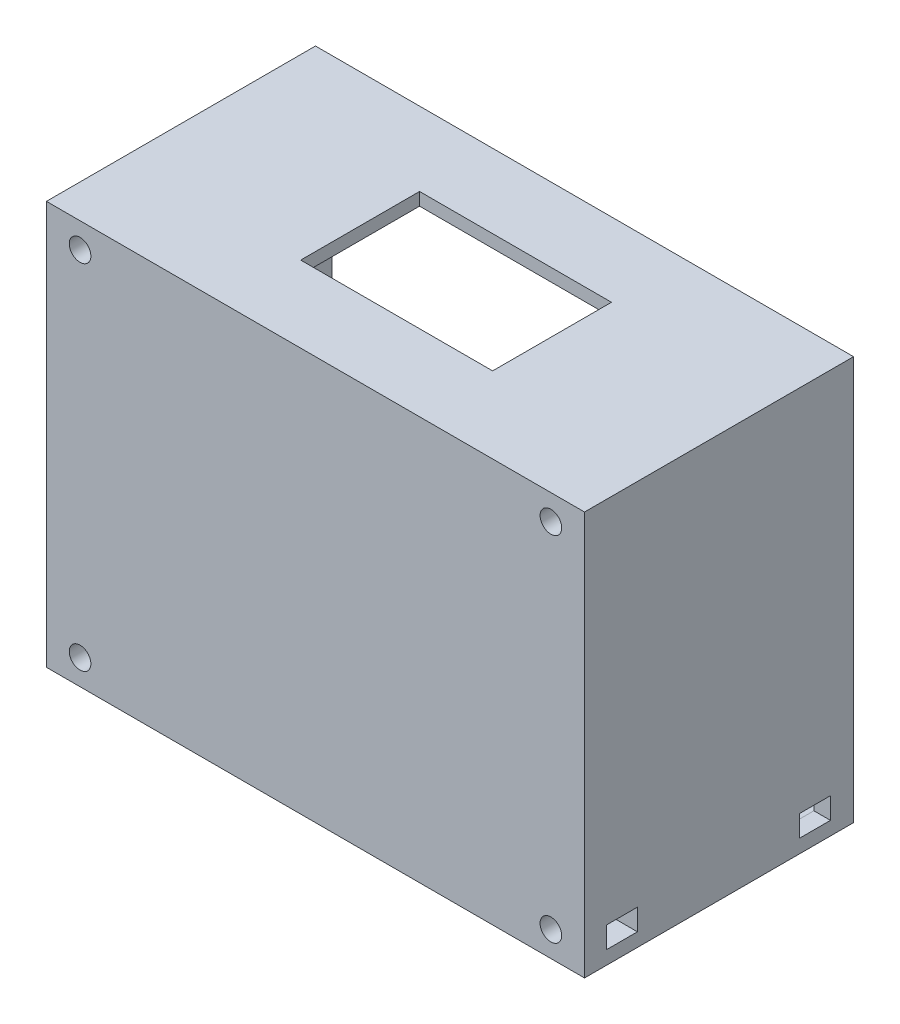
from build123d import *

# Parameters (mm, degrees)
ESBO_O1_W                = 200
ESBO_O1_H                = 150
ESBO_O1_R                = 4.015931703
RESSALTO_EXTRUS_O1_DEPTH = 100
ESBO_O2_W                = 187.670035944
ESBO_O2_H                = 140.530338622
CORTE_EXTRUS_O2_DEPTH    = 80
ESBO_O3_W                = 25.727524856
ESBO_O3_H                = 8.994175356
CORTE_EXTRUS_O3_DEPTH    = 103
ESBO_O4_W                = 11.504177781
ESBO_O4_H                = 7.948341013
CORTE_EXTRUS_O4_DEPTH    = 114
ESBO_O5_W                = 71.332240634
ESBO_O5_H                = 44.178578037
CORTE_EXTRUS_O5_DEPTH    = 114


with BuildPart() as part:
    # Esboço1 → Ressalto-extrusão1 (new body)
    with BuildSketch(Plane.XY):
        Rectangle(ESBO_O1_W, ESBO_O1_H)
        with Locations((-87.500730847, 65.625548135)):
            Circle(ESBO_O1_R, mode=Mode.SUBTRACT)
        with Locations(Location((-87.500730847, -65.625548135, 0), (0, 0, 180))):
            Circle(ESBO_O1_R, mode=Mode.SUBTRACT)
        with Locations(Location((87.500730847, 65.625548135, 0), (0, 0, 180))):
            Circle(ESBO_O1_R, mode=Mode.SUBTRACT)
        with Locations((87.500730847, -65.625548135)):
            Circle(ESBO_O1_R, mode=Mode.SUBTRACT)
    extrude(amount=RESSALTO_EXTRUS_O1_DEPTH)

    # Esboço2 → Corte-extrusão2 (cut)
    with BuildSketch(Plane.XY):
        Rectangle(ESBO_O2_W, ESBO_O2_H)
    extrude(amount=CORTE_EXTRUS_O2_DEPTH, mode=Mode.SUBTRACT)

    # Esboço3 → Corte-extrusão3 (cut)
    with BuildSketch(Plane(origin=(0, 0, 0), x_dir=(0, 0, -1), z_dir=(1, 0, 0))):
        with Locations((-20.821221809, -65.887563657)):
            Rectangle(ESBO_O3_W, ESBO_O3_H)
    extrude(amount=-CORTE_EXTRUS_O3_DEPTH, mode=Mode.SUBTRACT)

    # Esboço4 → Corte-extrusão4 (cut)
    with BuildSketch(Plane(origin=(0, 0, 0), x_dir=(0, 0, -1), z_dir=(1, 0, 0))):
        with Locations((-86.08128486, -65.992147092)):
            Rectangle(ESBO_O4_W, ESBO_O4_H)
        with Locations((-14.337048878, -65.992147092)):
            Rectangle(ESBO_O4_W, ESBO_O4_H)
    extrude(amount=CORTE_EXTRUS_O4_DEPTH, mode=Mode.SUBTRACT)

    # Esboço5 → Corte-extrusão5 (cut)
    with BuildSketch(Plane(origin=(0, 75, 0), x_dir=(1, 0, 0), z_dir=(0, 1, 0))):
        with Locations((1.831794699, -49.568989483)):
            Rectangle(ESBO_O5_W, ESBO_O5_H)
    extrude(amount=-CORTE_EXTRUS_O5_DEPTH, mode=Mode.SUBTRACT)


solid = part.part
